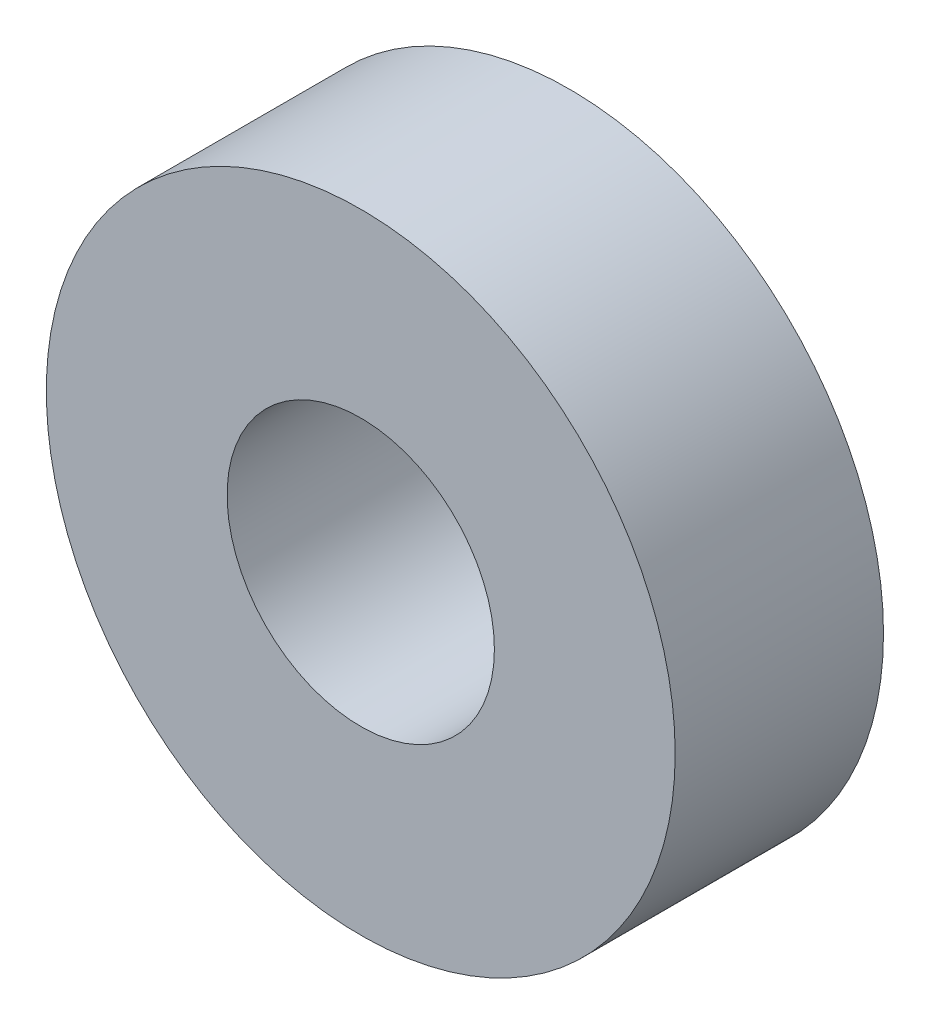
from build123d import *

# Parameters (mm, degrees)
SKETCH1_R           = 20
SKETCH1_R_2         = 8.5
BOSS_EXTRUDE1_DEPTH = 13.25


with BuildPart() as part:
    # Sketch1 → Boss-Extrude1 (new body)
    with BuildSketch(Plane.XY):
        Circle(SKETCH1_R)
        Circle(SKETCH1_R_2, mode=Mode.SUBTRACT)
    extrude(amount=BOSS_EXTRUDE1_DEPTH)


solid = part.part
